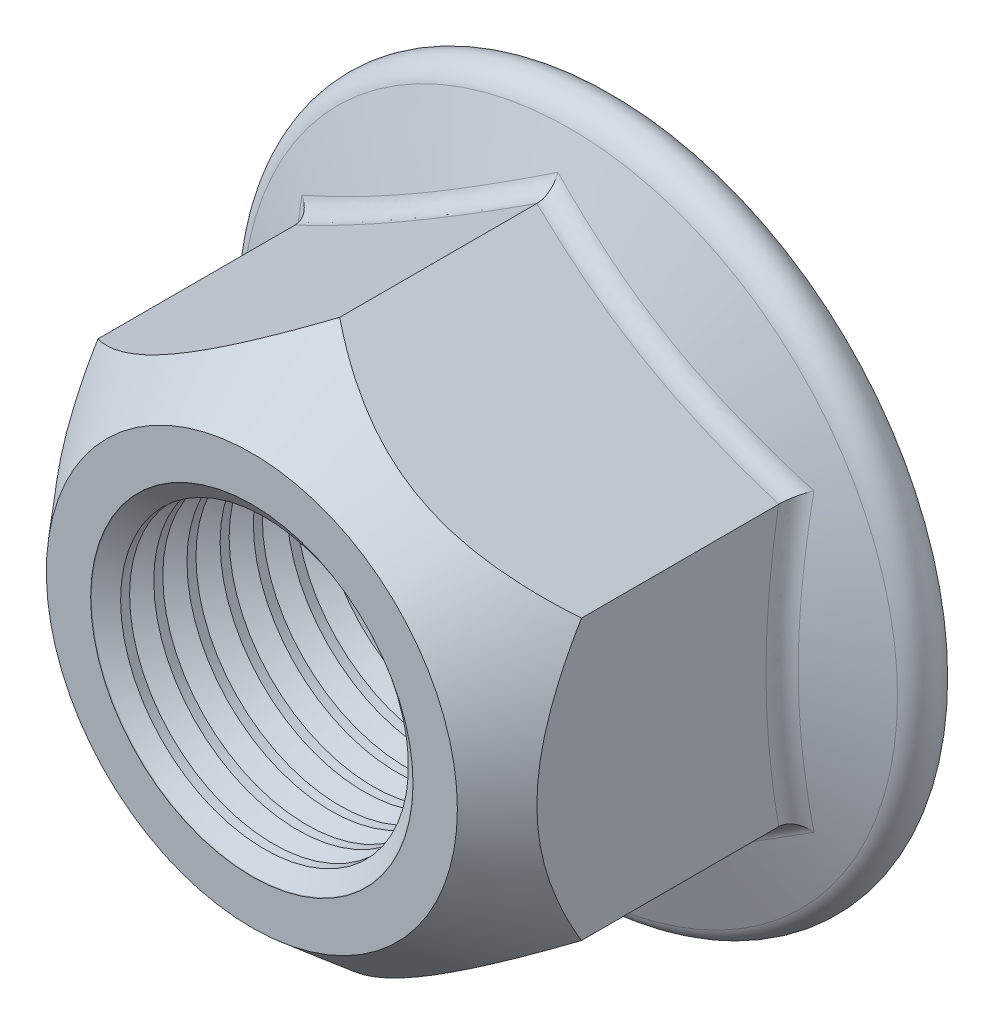
from build123d import *

# Parameters (mm, degrees)
BASENUT_START   = -15.9
BASENUTSKE_R    = 6.25
BASENUT_DEPTH   = 15.9
FLANGEFILLET_R  = 0.88
THDSCHPAT_COUNT = 11
THDSCHPAT_PITCH = 1.440836364


with BuildPart() as part:
    # BaseNutSke → BaseNut (new body)
    with BuildSketch(Plane.XY.offset(BASENUT_START)):
        Polygon((10.5, 6.062177826), (10.5, -6.062177826), (0, -12.124355653), (-10.5, -6.062177826), (-10.5, 6.062177826), (0, 12.124355653), align=None)
        Circle(BASENUTSKE_R, mode=Mode.SUBTRACT)
    extrude(amount=BASENUT_DEPTH)

    # Sketch6 → Flange (revolve)
    with BuildSketch(Plane(origin=(0, 0, 0), x_dir=(0, 0, -1), z_dir=(1, 0, 0)), mode=Mode.PRIVATE) as flange_sk:
        with BuildLine():
            Line((10.892736472, 6.25), (13.8, 14.237640895))
            ThreePointArc((13.8, 14.237640895), (15.0053537, 14.933552178), (15.9, 13.867354236))
            Line((15.9, 13.867354236), (15.9, 6.25))
            Line((15.9, 6.25), (10.892736472, 6.25))
        make_face()
    revolve(flange_sk.sketch.rotate(Axis((0, 0, 0), (0, 0, -1)), 90), axis=Axis((0, 0, 0), (0, 0, -1)))

    # Sketch3 → Double-Chamfer (revolve, cut)
    with BuildSketch(Plane(origin=(0, 0, 0), x_dir=(0, 0, -1), z_dir=(1, 0, 0)), mode=Mode.PRIVATE) as double_chamfer_sk:
        Polygon((3.812843593, 24.824355653), (-12.7, 24.824355653), (-12.7, 8.925), (0, 8.925), (3.812843593, 12.124355653), align=None)
    revolve(double_chamfer_sk.sketch.rotate(Axis((0, 0, 0), (0, 0, -1)), 300.000000044), axis=Axis((0, 0, 0), (0, 0, -1)), mode=Mode.SUBTRACT)

    # FlangeFillet
    flangefillet_edges = [part.edges().sort_by_distance(p)[0] for p in [
        (10.5, 3.044311508, -12.596998401),
        (5.25, 9.09326674, -12.439609968),
        (-5.25, 9.09326674, -12.439609968),
        (-10.5, 0, -12.439609968),
        (-5.25, -9.09326674, -12.439609968),
        (5.25, -9.09326674, -12.439609968),
        (10.5, -3.044311508, -12.596998401),
    ]]
    fillet(flangefillet_edges, radius=FLANGEFILLET_R)

    # Sketch5 → EndChamfer (revolve, cut)
    with BuildSketch(Plane(origin=(0, 0, 0), x_dir=(0, 0, -1), z_dir=(1, 0, 0)), mode=Mode.PRIVATE) as endchamfer_sk:
        Polygon((15.8746, 7), (15.296928781, 6.175), (15.9254, 6.175), (15.9254, 7), align=None)
        Polygon((-0.0508, 7), (0, 7), (0.577671219, 6.175), (-0.0508, 6.175), align=None)
    revolve(endchamfer_sk.sketch.rotate(Axis((0, 0, -25.037505729), (0, 0, -1)), 90), axis=Axis((0, 0, -25.037505729), (0, 0, -1)), mode=Mode.SUBTRACT)

    # ThdSchSke → ThreadSchematic (revolve, cut)
    with BuildSketch(Plane(origin=(0, 0, 0), x_dir=(1, 0, 0), z_dir=(0, 1, 0))):
        Polygon((-7, 0.0254), (-6.25, 0.550555654), (-3.125, 0.550555654), (-3.125, -0.499755654), (-6.25, -0.499755654), align=None)
    threadschematic = revolve(axis=Axis((0, 0, -1.5), (0, 0, 1)), mode=Mode.SUBTRACT)

    # ThdSchPat: ThreadSchematic ×11
    with Locations(*[(0, 0, -i * THDSCHPAT_PITCH) for i in range(1, THDSCHPAT_COUNT)]):
        add(threadschematic, mode=Mode.SUBTRACT)


solid = part.part
